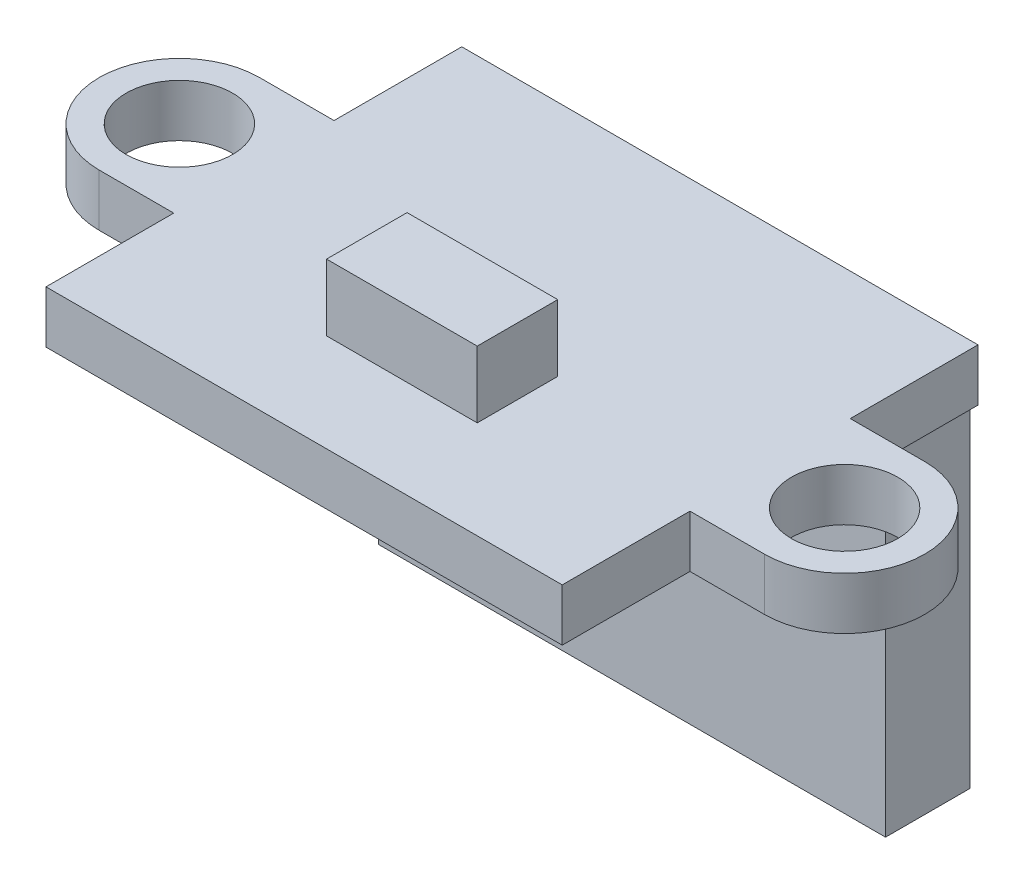
from build123d import *

# Parameters (mm, degrees)
SKETCH1_R           = 1.6
BOSS_EXTRUDE1_DEPTH = 1.57
SKETCH2_W           = 4.53
SKETCH2_H           = 2.42
BOSS_EXTRUDE2_DEPTH = 2
SKETCH3_W           = 15.24
SKETCH3_H           = 2.54
BOSS_EXTRUDE3_DEPTH = 10


with BuildPart() as part:
    # Sketch1 → Boss-Extrude1 (new body)
    with BuildSketch(Plane(origin=(0, 0, 0), x_dir=(1, 0, 0), z_dir=(0, 1, 0))):
        with BuildLine():
            Line((-7.76, -6.25), (7.76, -6.25))
            Line((7.76, -6.25), (7.76, -2.41))
            Line((7.76, -2.41), (10, -2.41))
            ThreePointArc((10, -2.41), (12.41, 0), (10, 2.41))
            Line((10, 2.41), (7.76, 2.41))
            Line((7.76, 2.41), (7.76, 6.25))
            Line((7.76, 6.25), (-7.76, 6.25))
            Line((-7.76, 6.25), (-7.76, 2.41))
            Line((-7.76, 2.41), (-10, 2.41))
            ThreePointArc((-10, 2.41), (-12.41, 0), (-10, -2.41))
            Line((-10, -2.41), (-7.76, -2.41))
            Line((-7.76, -2.41), (-7.76, -6.25))
        make_face()
        with Locations(Location((-10, 0, 0), (0, 0, 270))):
            Circle(SKETCH1_R, mode=Mode.SUBTRACT)
        with Locations(Location((10, 0, 0), (0, 0, 270))):
            Circle(SKETCH1_R, mode=Mode.SUBTRACT)
    extrude(amount=BOSS_EXTRUDE1_DEPTH)

    # Sketch2 → Boss-Extrude2 (add)
    with BuildSketch(Plane(origin=(0, 1.57, 0), x_dir=(1, 0, 0), z_dir=(0, 1, 0))):
        with Locations((0, -2.1)):
            Rectangle(SKETCH2_W, SKETCH2_H)
    extrude(amount=BOSS_EXTRUDE2_DEPTH)

    # Sketch3 → Boss-Extrude3 (add)
    with BuildSketch(Plane.XZ):
        with Locations((0, -4.88)):
            Rectangle(SKETCH3_W, SKETCH3_H)
    extrude(amount=BOSS_EXTRUDE3_DEPTH)


solid = part.part
